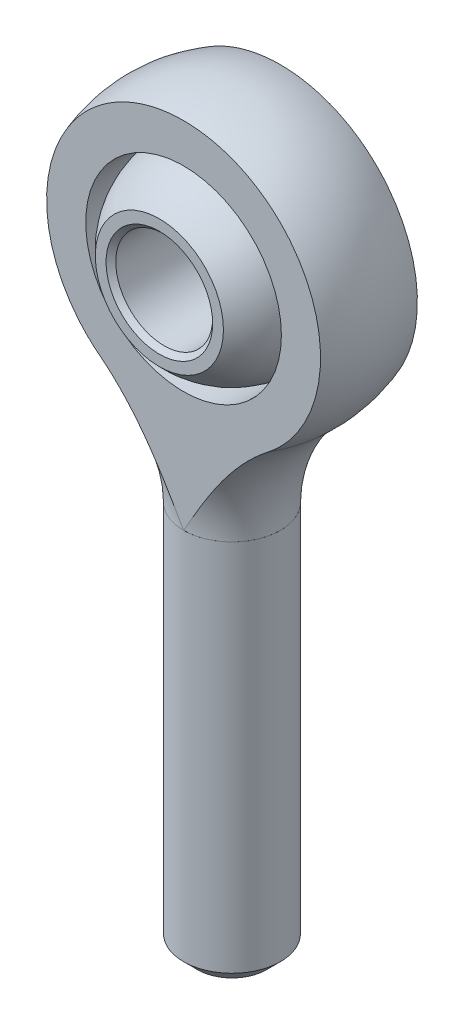
from build123d import *

# Parameters (mm, degrees)
SKETCH14_W               = 3.175
SKETCH14_H               = 25.4
CUT_EXTRUDE10_DEPTH      = 29.750847814
CUT_EXTRUDE10_DEPTH_BACK = 29.750847814
CUT_EXTRUDE9_DEPTH       = 28.312382734
CUT_EXTRUDE9_DEPTH_BACK  = 28.312382734
SKETCH17_R               = 6.4135
CUT_EXTRUDE4_DEPTH       = 28.86051193
CUT_EXTRUDE4_DEPTH_BACK  = 28.86051193
SKETCH10_R               = 3.175
CUT_EXTRUDE7_START       = -4.7625
SKETCH22_W               = 19.05
SKETCH22_H               = 23.8125
CUT_EXTRUDE7_DEPTH       = 24.09801193
CUT_EXTRUDE8_START       = 4.7625
SKETCH23_W               = 19.05
SKETCH23_H               = 23.8125
CUT_EXTRUDE8_DEPTH       = 24.09801193
CHAMFER1_SIZE            = 0.90678
CHAMFER2_SIZE            = 0.3175


with BuildPart() as part:
    # Sketch14 → Revolve4 (revolve)
    with BuildSketch(Plane.XY, mode=Mode.PRIVATE) as revolve4_sk:
        with Locations((1.5875, -12.7)):
            Rectangle(SKETCH14_W, SKETCH14_H)
    revolve(revolve4_sk.sketch.rotate(Axis((0, 0, 0), (0, -1, 0)), 180), axis=Axis((0, 0, 0), (0, -1, 0)))

    # Chamfer1
    chamfer1_edges = [part.edges().sort_by_distance(p)[0] for p in [
        (3.175, -25.4, 0),
    ]]
    chamfer(chamfer1_edges, length=CHAMFER1_SIZE)


with BuildPart() as body_2:
    # Sketch21 → Revolve5 (revolve)
    with BuildSketch(Plane.XY):
        with BuildLine():
            Line((0, 23.8125), (0, 0))
            Line((0, 0), (3.175, 0))
            ThreePointArc((3.175, 0), (4.01304802, 3.949061991), (6.382731959, 7.217396907))
            ThreePointArc((6.382731959, 7.217396907), (8.890116899, 17.70677573), (0, 23.8125))
        make_face()
    revolve(axis=Axis((0, 0, 0), (0, -1, 0)))

    # Sketch24 → Cut-Extrude10 (cut, two sides: drawn at the far end of the back side and taken through both)
    with BuildSketch(Plane(origin=(0, 0, 0), x_dir=(0, 0, -1), z_dir=(1, 0, 0)).offset(-CUT_EXTRUDE10_DEPTH_BACK)):
        Polygon((3.175, 14.2875), (3.175, 23.8125), (9.525, 23.8125), (9.525, 0), (3.175, 0), (3.175, 0.635), align=None)
        Polygon((-3.175, 0), (-9.525, 0), (-9.525, 23.8125), (-3.175, 23.8125), (-3.175, 14.2875), (-3.175, 0.635), align=None)
    extrude(amount=CUT_EXTRUDE10_DEPTH + CUT_EXTRUDE10_DEPTH_BACK, mode=Mode.SUBTRACT)

    # Sketch17 → Cut-Extrude9 (cut, two sides: drawn at the far end of the back side and taken through both)
    with BuildSketch(Plane.XY.offset(-CUT_EXTRUDE9_DEPTH_BACK)):
        with Locations((0, 14.2875)):
            Circle(SKETCH17_R)
    extrude(amount=CUT_EXTRUDE9_DEPTH + CUT_EXTRUDE9_DEPTH_BACK, mode=Mode.SUBTRACT)


with BuildPart() as body_3:
    # Sketch7 → Revolve3 (revolve)
    with BuildSketch(Plane.XY):
        with BuildLine():
            Line((0, 20.6375), (0, 7.9375))
            ThreePointArc((0, 7.9375), (6.35, 14.2875), (0, 20.6375))
        make_face()
    revolve(axis=Axis((0, 0, 0), (0, 1, 0)))

    # Sketch10 → Cut-Extrude4 (cut, two sides: drawn at the far end of the back side and taken through both)
    with BuildSketch(Plane.XY.offset(-CUT_EXTRUDE4_DEPTH_BACK)):
        with Locations(Location((0, 14.2875, 0), (0, 0, 180))):
            Circle(SKETCH10_R)
    extrude(amount=CUT_EXTRUDE4_DEPTH + CUT_EXTRUDE4_DEPTH_BACK, mode=Mode.SUBTRACT)

    # Sketch22 → Cut-Extrude7 (cut, through all)
    with BuildSketch(Plane.XY.offset(CUT_EXTRUDE7_START)):
        with Locations((0, 11.90625)):
            Rectangle(SKETCH22_W, SKETCH22_H)
    extrude(amount=-CUT_EXTRUDE7_DEPTH, mode=Mode.SUBTRACT)

    # Sketch23 → Cut-Extrude8 (cut, through all)
    with BuildSketch(Plane.XY.offset(CUT_EXTRUDE8_START)):
        with Locations((0, 11.90625)):
            Rectangle(SKETCH23_W, SKETCH23_H)
    extrude(amount=CUT_EXTRUDE8_DEPTH, mode=Mode.SUBTRACT)

    # Chamfer2
    chamfer2_edges = [body_3.edges().sort_by_distance(p)[0] for p in [
        (3.175, 14.2875, -4.7625),
        (3.175, 14.2875, 4.7625),
    ]]
    chamfer(chamfer2_edges, length=CHAMFER2_SIZE)


solid = Compound([part.part, body_2.part, body_3.part])
